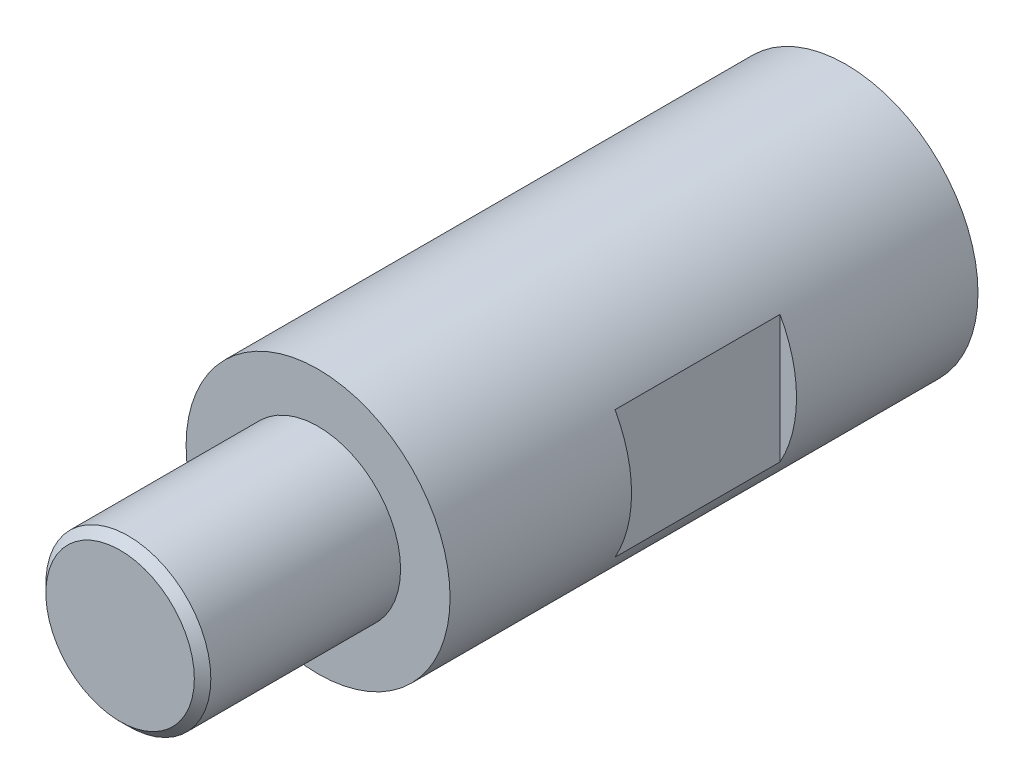
from build123d import *

# Parameters (mm, degrees)
SKETCH_1_R                   = 8
EXTRUDE_1_DEPTH              = 32
SKETCH_2_W                   = 1
SKETCH_2_H                   = 10
CUT_EXTRUDE_2_DEPTH          = 9.25
HOLE_WIZARD_M8_1_D           = 6.8
HOLE_WIZARD_M8_1_DEPTH       = 19.75
HOLE_WIZARD_M8_1_CBORE_D     = 8
HOLE_WIZARD_M8_1_CBORE_DEPTH = 16
HOLE_WIZARD_M8_1_TIP         = 2.042926105
SKETCH_4_R                   = 5
EXTRUDE_3_DEPTH              = 12
CHAMFER_1_SIZE               = 0.5
SKETCH_5_W                   = 1.5
SKETCH_5_H                   = 0.069985642


with BuildPart() as part:
    # 草图1 → 拉伸1 (new body)
    with BuildSketch(Plane.XY):
        Circle(SKETCH_1_R)
    extrude(amount=EXTRUDE_1_DEPTH)

    # 草图2 → 拉伸2 (cut, symmetric)
    with BuildSketch(Plane(origin=(0, 0, 0), x_dir=(1, 0, 0), z_dir=(0, 1, 0))):
        with Locations((-7.5, -16)):
            Rectangle(SKETCH_2_W, SKETCH_2_H)
        with Locations((7.5, -16)):
            Rectangle(SKETCH_2_W, SKETCH_2_H)
    extrude(amount=CUT_EXTRUDE_2_DEPTH, both=True, mode=Mode.SUBTRACT)

    # M8 螺纹孔1
    with Locations(Plane(origin=(0, 0, 0), x_dir=(-1, 0, 0), z_dir=(0, 0, -1))):
        with Locations((0, 0)):
            CounterBoreHole(HOLE_WIZARD_M8_1_D / 2, HOLE_WIZARD_M8_1_CBORE_D / 2, HOLE_WIZARD_M8_1_CBORE_DEPTH, depth=HOLE_WIZARD_M8_1_DEPTH)
            with Locations((0, 0, -(HOLE_WIZARD_M8_1_DEPTH + HOLE_WIZARD_M8_1_TIP / 2))):  # 118° drill point
                Cone(0, HOLE_WIZARD_M8_1_D / 2, HOLE_WIZARD_M8_1_TIP, mode=Mode.SUBTRACT)

    # 草图4 → 拉伸3 (add)
    with BuildSketch(Plane.XY.offset(32)):
        Circle(SKETCH_4_R)
    extrude(amount=EXTRUDE_3_DEPTH)

    # 倒角1
    chamfer_1_edges = [part.edges().sort_by_distance(p)[0] for p in [
        (-5, 0, 44),
    ]]
    chamfer(chamfer_1_edges, length=CHAMFER_1_SIZE)

    # 草图5 → 切除-旋转1 (revolve, cut)
    with BuildSketch(Plane(origin=(0, 0, 0), x_dir=(0, 0, -1), z_dir=(1, 0, 0)), mode=Mode.PRIVATE) as cut_revolve_1_sk:
        with Locations((-32.75, 4.465007179)):
            Rectangle(SKETCH_5_W, SKETCH_5_H)
    revolve(cut_revolve_1_sk.sketch.rotate(Axis((0, 0, 32), (0, 0, -1)), 90), axis=Axis((0, 0, 32), (0, 0, -1)), mode=Mode.SUBTRACT)


solid = part.part
